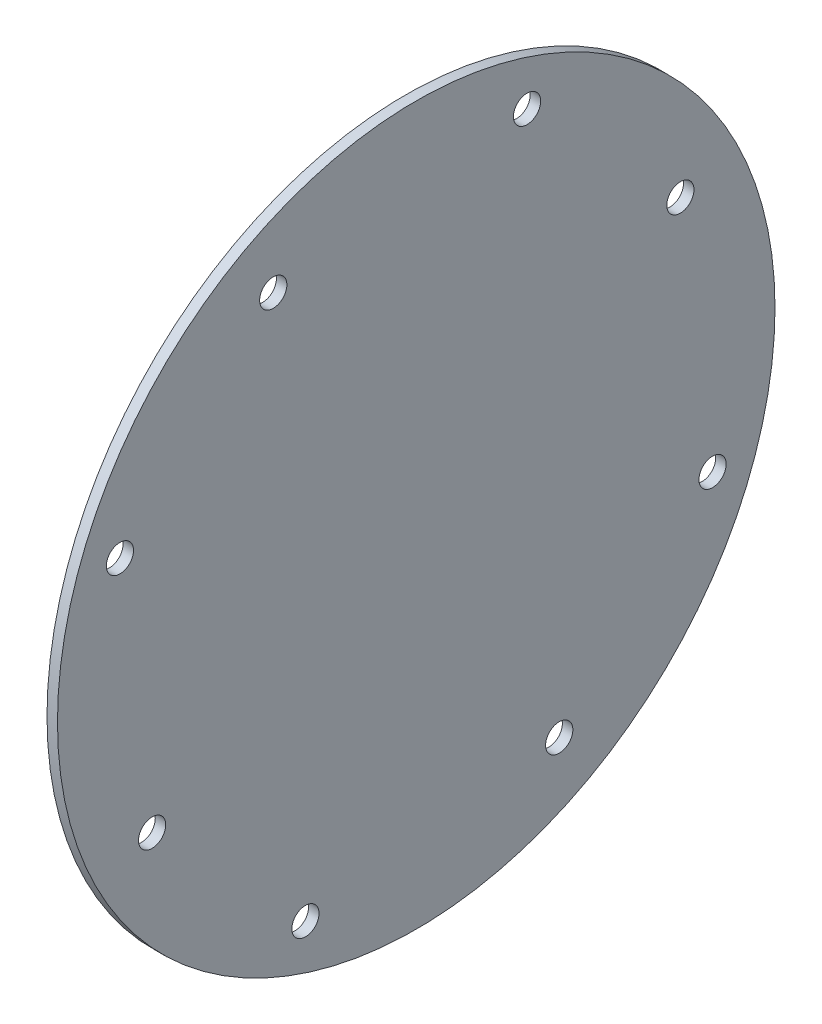
from build123d import *

# Parameters (mm, degrees)
SKETCH1_R           = 86.995
SKETCH1_R_2         = 3.302
BOSS_EXTRUDE1_DEPTH = 2.54


with BuildPart() as part:
    # Sketch1 → Boss-Extrude1 (new body)
    with BuildSketch(Plane.YZ):
        with Locations(Location((0, 0, 0), (0, 0, 270))):
            Circle(SKETCH1_R)
        with Locations(Location((26.867048584, 71.849001137, 0), (0, 0, 270))):
            Circle(SKETCH1_R_2, mode=Mode.SUBTRACT)
        with Locations(Location((64.045308925, 34.670740796, 0), (0, 0, 270))):
            Circle(SKETCH1_R_2, mode=Mode.SUBTRACT)
        with Locations(Location((71.849001137, -26.867048584, 0), (0, 0, 270))):
            Circle(SKETCH1_R_2, mode=Mode.SUBTRACT)
        with Locations(Location((34.670740796, -64.045308925, 0), (0, 0, 270))):
            Circle(SKETCH1_R_2, mode=Mode.SUBTRACT)
        with Locations(Location((-26.867048584, -71.849001137, 0), (0, 0, 270))):
            Circle(SKETCH1_R_2, mode=Mode.SUBTRACT)
        with Locations(Location((-64.045308925, -34.670740796, 0), (0, 0, 270))):
            Circle(SKETCH1_R_2, mode=Mode.SUBTRACT)
        with Locations(Location((-71.849001137, 26.867048584, 0), (0, 0, 270))):
            Circle(SKETCH1_R_2, mode=Mode.SUBTRACT)
        with Locations(Location((-34.670740796, 64.045308925, 0), (0, 0, 270))):
            Circle(SKETCH1_R_2, mode=Mode.SUBTRACT)
    extrude(amount=BOSS_EXTRUDE1_DEPTH)


solid = part.part
